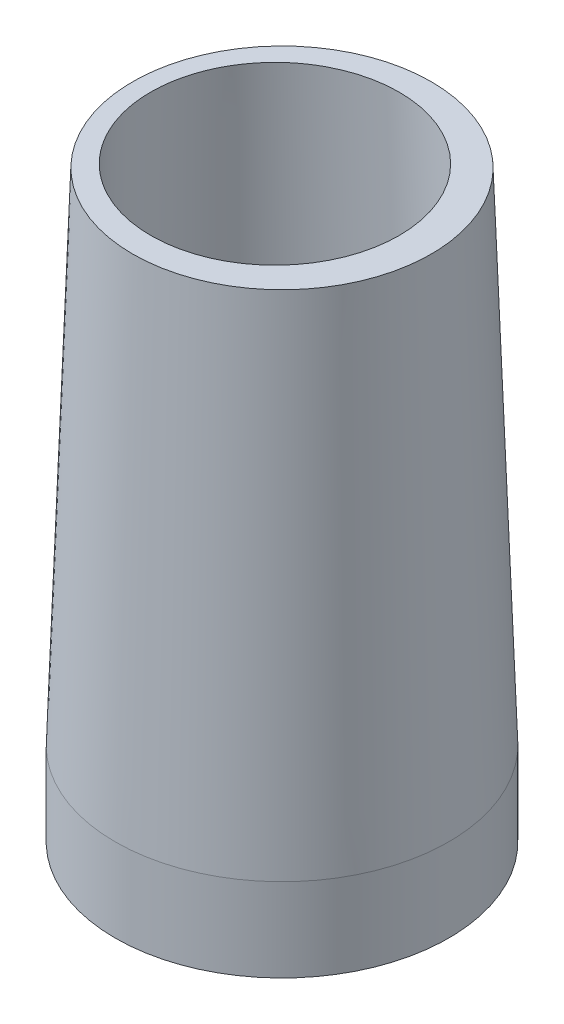
from build123d import *

# Parameters (mm, degrees)
SKETCH_1_R                = 20
EXTRUDE_1_DEPTH           = 60
EXTRUDE_1_TAPER           = 2
EXTRUDE_1_OTHER_WAY_DEPTH = 10


with BuildPart() as part:
    # Эскиз1 → Бобышка-Вытянуть1 (new body)
    with BuildSketch(Plane(origin=(0, 0, 0), x_dir=(1, 0, 0), z_dir=(0, 1, 0))):
        with Locations(Location((0, 0, 0), (0, 0, 270))):
            Circle(SKETCH_1_R)
    extrude(amount=EXTRUDE_1_DEPTH, taper=EXTRUDE_1_TAPER)

    # Эскиз1 → Бобышка-Вытянуть1 other way (add)
    with BuildSketch(Plane(origin=(0, 0, 0), x_dir=(1, 0, 0), z_dir=(0, 1, 0))):
        with Locations(Location((0, 0, 0), (0, 0, 270))):
            Circle(SKETCH_1_R)
    extrude(amount=-EXTRUDE_1_OTHER_WAY_DEPTH)

    # Эскиз3 → Вырез-Повернуть1 (revolve, cut)
    with BuildSketch(Plane.XY, mode=Mode.PRIVATE) as cut_revolve_1_sk:
        Polygon((-15.743928258, 60), (-17.001715566, 0), (-17.001715566, -7.030322503), (-9.901128706, -7.030322503), (0.031057723, -2.186071506), (-0.852425624, 60), align=None)
    revolve(cut_revolve_1_sk.sketch.rotate(Axis((0.031057723, -2.186071506, 0), (-0.014205660156622533, 0.9998990945187992, 0)), 180), axis=Axis((0.031057723, -2.186071506, 0), (-0.014205660156622533, 0.9998990945187992, 0)), mode=Mode.SUBTRACT)


solid = part.part
